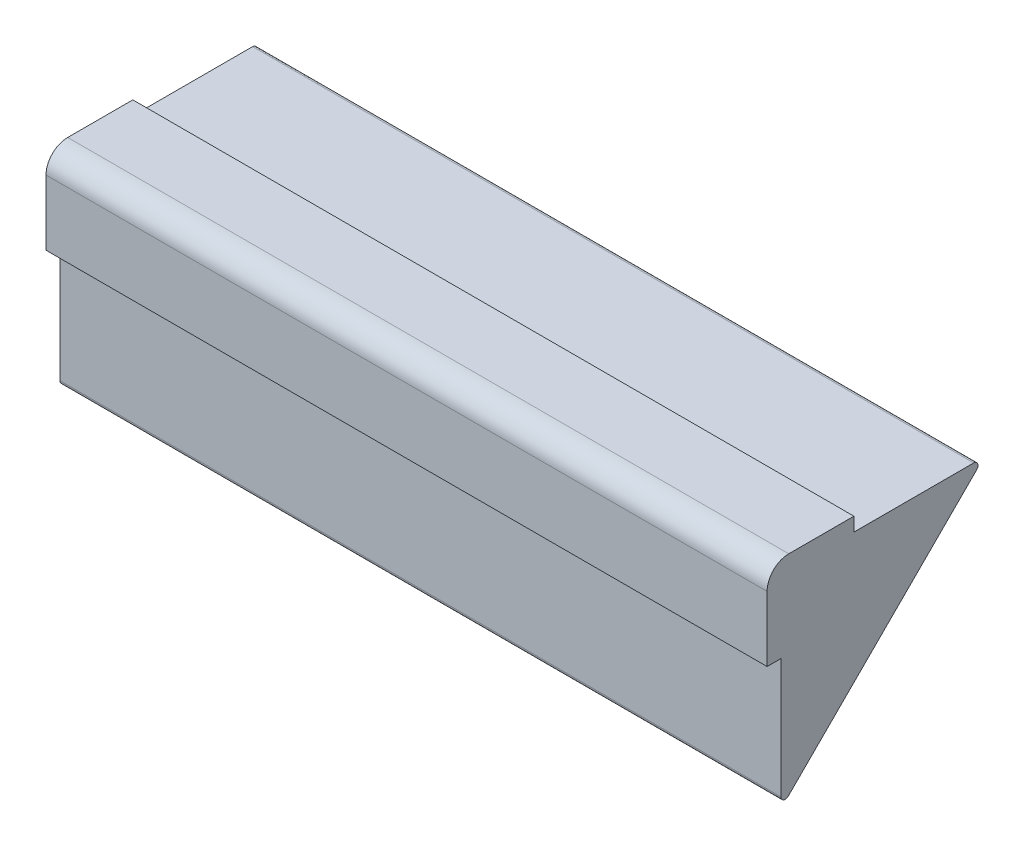
from build123d import *

# Parameters (mm, degrees)
BOSS_EXTRUDE1_DEPTH = 166.124


with BuildPart() as part:
    # Sketch1 → Boss-Extrude1 (new body)
    with BuildSketch(Plane(origin=(0, 0, 0), x_dir=(0, 0, -1), z_dir=(1, 0, 0))):
        with BuildLine():
            Line((0, -20), (0, -5))
            ThreePointArc((0, -5), (1.464466094, -1.464466094), (5, 0))
            Line((5, 0), (20, 0))
            Line((20, 0), (20, -3.175))
            Line((20, -3.175), (47.585786438, -3.175))
            ThreePointArc((47.585786438, -3.175), (48.50966597, -3.792316568), (48.292893219, -4.882106781))
            Line((48.292893219, -4.882106781), (4.882106781, -48.292893219))
            ThreePointArc((4.882106781, -48.292893219), (3.792316568, -48.50966597), (3.175, -47.585786438))
            Line((3.175, -47.585786438), (3.175, -20))
            Line((3.175, -20), (0, -20))
        make_face()
    extrude(amount=BOSS_EXTRUDE1_DEPTH)


solid = part.part
